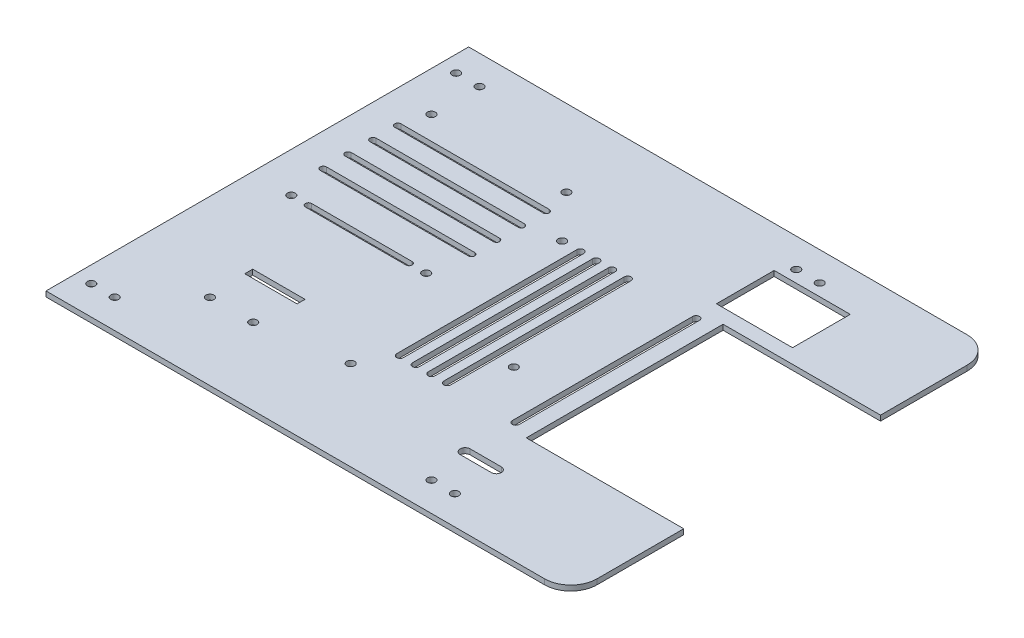
from build123d import *

# Parameters (mm, degrees)
BOSS_EXTRUDE1_DEPTH = 2
SKETCH2_R           = 1.5
SKETCH2_W           = 19.920515559
SKETCH2_H           = 3.018311412
SKETCH2_W_2         = 29
SKETCH2_H_2         = 22
CUT_EXTRUDE1_DEPTH  = 2
FILLET1_R           = 10


with BuildPart() as part:
    # Sketch1 → Boss-Extrude1 (new body)
    with BuildSketch(Plane(origin=(0, 0, 0), x_dir=(1, 0, 0), z_dir=(0, 1, 0))):
        Polygon((62.5, -37.5), (62.5, -80.53), (-137.5, -80.53), (-137.5, 80.53), (62.5, 80.53), (62.5, 37.5), (2.5, 37.5), (2.5, -37.5), align=None)
    extrude(amount=BOSS_EXTRUDE1_DEPTH)

    # Sketch2 → Cut-Extrude1 (cut)
    with BuildSketch(Plane(origin=(0, 2, 0), x_dir=(1, 0, 0), z_dir=(0, 1, 0))):
        with Locations(Location((-131.256523302, -69.515826612, 0), (0, 0, 270))):
            Circle(SKETCH2_R)
        with Locations(Location((7.303150728, -69.515826612, 0), (0, 0, 270))):
            Circle(SKETCH2_R)
        with Locations(Location((-131.256523302, 69.515826612, 0), (0, 0, 90))):
            Circle(SKETCH2_R)
        with Locations(Location((7.303150728, 69.515826612, 0), (0, 0, 90))):
            Circle(SKETCH2_R)
        with Locations(Location((-122.332492344, -69.515826612, 0), (0, 0, 270))):
            Circle(SKETCH2_R)
        with Locations(Location((-1.623456056, -69.515826612, 0), (0, 0, 270))):
            Circle(SKETCH2_R)
        with Locations(Location((-1.623456056, 69.515826612, 0), (0, 0, 270))):
            Circle(SKETCH2_R)
        with Locations(Location((-122.332492344, 69.515826612, 0), (0, 0, 270))):
            Circle(SKETCH2_R)
        with Locations(Location((-23.238563778, -16.512077665, 0), (0, 0, 270))):
            Circle(SKETCH2_R)
        with Locations(Location((-55.491043914, -46.437145858, 0), (0, 0, 270))):
            Circle(SKETCH2_R)
        with Locations(Location((-55.618758711, 34.282977792, 0), (0, 0, 270))):
            Circle(SKETCH2_R)
        with Locations(Location((-70.912492344, 51.192828944, 0), (0, 0, 270))):
            Circle(SKETCH2_R)
        with Locations(Location((-122.332492344, 51.192828944, 0), (0, 0, 270))):
            Circle(SKETCH2_R)
        with Locations(Location((-122.332492344, -2.227171201, 0), (0, 0, 270))):
            Circle(SKETCH2_R)
        with Locations(Location((-70.912492344, -2.227171201, 0), (0, 0, 270))):
            Circle(SKETCH2_R)
        with Locations(Location((-104.14455224, -51.392693568, 0), (0, 0, 270))):
            Circle(SKETCH2_R)
        with Locations(Location((-87.673175627, -51.392693568, 0), (0, 0, 270))):
            Circle(SKETCH2_R)
        with BuildLine():
            Line((-3.265151958, 34.282977792), (-3.265151958, -34.42226179))
            ThreePointArc((-3.265151958, -34.42226179), (-4.562464061, -35.719573893), (-5.859776165, -34.42226179))
            Line((-5.859776165, -34.42226179), (-5.859776165, 34.282977792))
            ThreePointArc((-5.859776165, 34.282977792), (-4.562464061, 35.580289895), (-3.265151958, 34.282977792))
        make_face()
        with BuildLine():
            Line((-29.373558034, 34.282977792), (-29.373558034, -34.42226179))
            ThreePointArc((-29.373558034, -34.42226179), (-30.670870138, -35.719573893), (-31.968182241, -34.42226179))
            Line((-31.968182241, -34.42226179), (-31.968182241, 34.282977792))
            ThreePointArc((-31.968182241, 34.282977792), (-30.670870138, 35.580289895), (-29.373558034, 34.282977792))
        make_face()
        with BuildLine():
            Line((-35.373558034, 34.282977792), (-35.373558034, -34.42226179))
            ThreePointArc((-35.373558034, -34.42226179), (-36.670870138, -35.719573893), (-37.968182241, -34.42226179))
            Line((-37.968182241, -34.42226179), (-37.968182241, 34.282977792))
            ThreePointArc((-37.968182241, 34.282977792), (-36.670870138, 35.580289895), (-35.373558034, 34.282977792))
        make_face()
        with BuildLine():
            Line((-41.373558034, 34.282977792), (-41.373558034, -34.42226179))
            ThreePointArc((-41.373558034, -34.42226179), (-42.670870138, -35.719573893), (-43.968182241, -34.42226179))
            Line((-43.968182241, -34.42226179), (-43.968182241, 34.282977792))
            ThreePointArc((-43.968182241, 34.282977792), (-42.670870138, 35.580289895), (-41.373558034, 34.282977792))
        make_face()
        with BuildLine():
            Line((-47.373558034, 34.282977792), (-47.373558034, -34.42226179))
            ThreePointArc((-47.373558034, -34.42226179), (-48.670870138, -35.719573893), (-49.968182241, -34.42226179))
            Line((-49.968182241, -34.42226179), (-49.968182241, 34.282977792))
            ThreePointArc((-49.968182241, 34.282977792), (-48.670870138, 35.580289895), (-47.373558034, 34.282977792))
        make_face()
        with BuildLine():
            Line((-115.769074494, -1.056435162), (-77.456824006, -1.056435162))
            ThreePointArc((-77.456824006, -1.056435162), (-76.286087967, -2.227171201), (-77.456824006, -3.39790724))
            Line((-77.456824006, -3.39790724), (-115.769074494, -3.39790724))
            ThreePointArc((-115.769074494, -3.39790724), (-116.939810532, -2.227171201), (-115.769074494, -1.056435162))
        make_face()
        with Locations((-95.335675627, -35.460717912)):
            Rectangle(SKETCH2_W, SKETCH2_H)
        with BuildLine():
            Line((-68.521094286, 39.924878234), (-125.034135879, 39.924878234))
            ThreePointArc((-125.034135879, 39.924878234), (-126.207275741, 41.098018096), (-125.034135879, 42.271157959))
            Line((-125.034135879, 42.271157959), (-68.521094286, 42.271157959))
            ThreePointArc((-68.521094286, 42.271157959), (-67.347954424, 41.098018096), (-68.521094286, 39.924878234))
        make_face()
        with BuildLine():
            Line((-68.521094286, 30.449255701), (-125.034135879, 30.449255701))
            ThreePointArc((-125.034135879, 30.449255701), (-126.207275741, 31.622395563), (-125.034135879, 32.795535426))
            Line((-125.034135879, 32.795535426), (-68.521094286, 32.795535426))
            ThreePointArc((-68.521094286, 32.795535426), (-67.347954424, 31.622395563), (-68.521094286, 30.449255701))
        make_face()
        with BuildLine():
            Line((-68.521094286, 20.973633168), (-125.034135879, 20.973633168))
            ThreePointArc((-125.034135879, 20.973633168), (-126.207275741, 22.14677303), (-125.034135879, 23.319912892))
            Line((-125.034135879, 23.319912892), (-68.521094286, 23.319912892))
            ThreePointArc((-68.521094286, 23.319912892), (-67.347954424, 22.14677303), (-68.521094286, 20.973633168))
        make_face()
        with BuildLine():
            Line((-68.521094286, 11.498010634), (-125.034135879, 11.498010634))
            ThreePointArc((-125.034135879, 11.498010634), (-126.207275741, 12.671150497), (-125.034135879, 13.844290359))
            Line((-125.034135879, 13.844290359), (-68.521094286, 13.844290359))
            ThreePointArc((-68.521094286, 13.844290359), (-67.347954424, 12.671150497), (-68.521094286, 11.498010634))
        make_face()
        with Locations((8.983260953, 53.984235798)):
            Rectangle(SKETCH2_W_2, SKETCH2_H_2)
        with BuildLine():
            Line((7.303150728, -51.824271767), (-4.562464061, -51.824271767))
            ThreePointArc((-4.562464061, -51.824271767), (-6.461969906, -53.723777612), (-4.562464061, -55.623283456))
            Line((-4.562464061, -55.623283456), (7.303150728, -55.623283456))
            ThreePointArc((7.303150728, -55.623283456), (9.202656572, -53.723777612), (7.303150728, -51.824271767))
        make_face()
    extrude(amount=-CUT_EXTRUDE1_DEPTH, mode=Mode.SUBTRACT)

    # Fillet1
    fillet1_edges = [part.edges().sort_by_distance(p)[0] for p in [
        (62.5, 1, -80.53),
        (62.5, 1, 80.53),
    ]]
    fillet(fillet1_edges, radius=FILLET1_R)


solid = part.part
